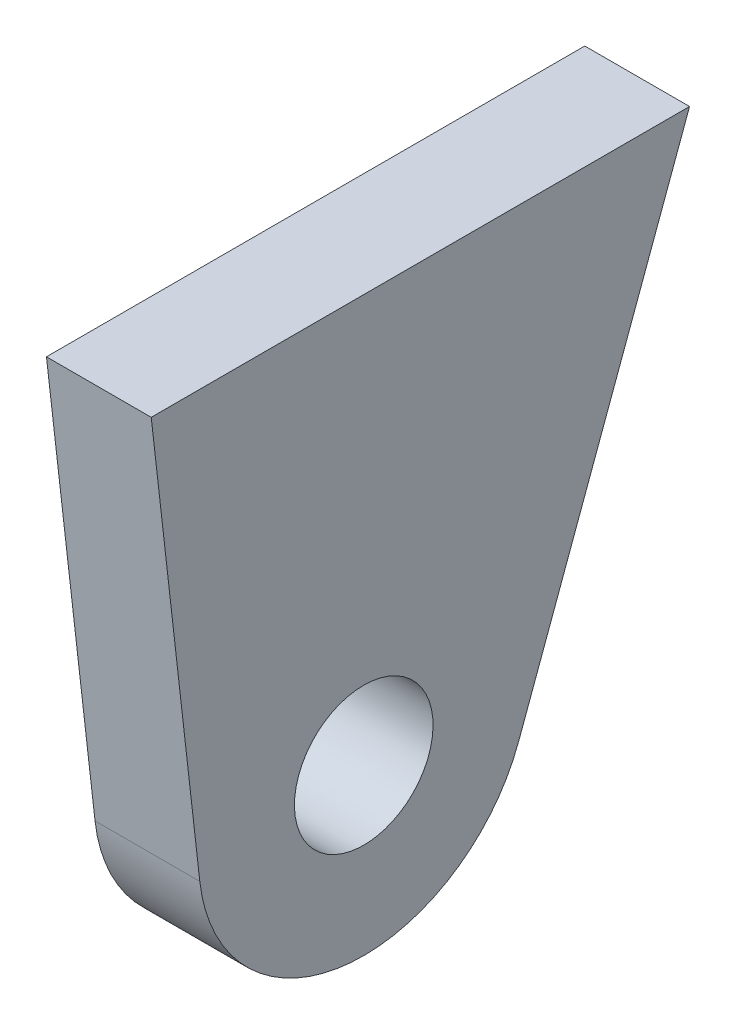
from build123d import *

# Parameters (mm, degrees)
SKETCH2_R           = 4.2
BOSS_EXTRUDE2_DEPTH = 6.35


with BuildPart() as part:
    # Sketch2 → Boss-Extrude2 (new body)
    with BuildSketch(Plane(origin=(-106.214962915, 0, 0), x_dir=(0, 0, -1), z_dir=(1, 0, 0))):
        with BuildLine():
            Line((916.713582015, -360.677443288), (927.075106991, -332.523601629))
            Line((927.075106991, -332.523601629), (894.448362552, -332.523601629))
            Line((894.448362552, -332.523601629), (897.39332308, -358.356278755))
            ThreePointArc((897.39332308, -358.356278755), (906.13613116, -367.152203744), (916.713582015, -360.677443288))
        make_face()
        with Locations(Location((907.328968128, -357.223601629, 0), (0, 0, 90))):
            Circle(SKETCH2_R, mode=Mode.SUBTRACT)
    extrude(amount=BOSS_EXTRUDE2_DEPTH)


solid = part.part
